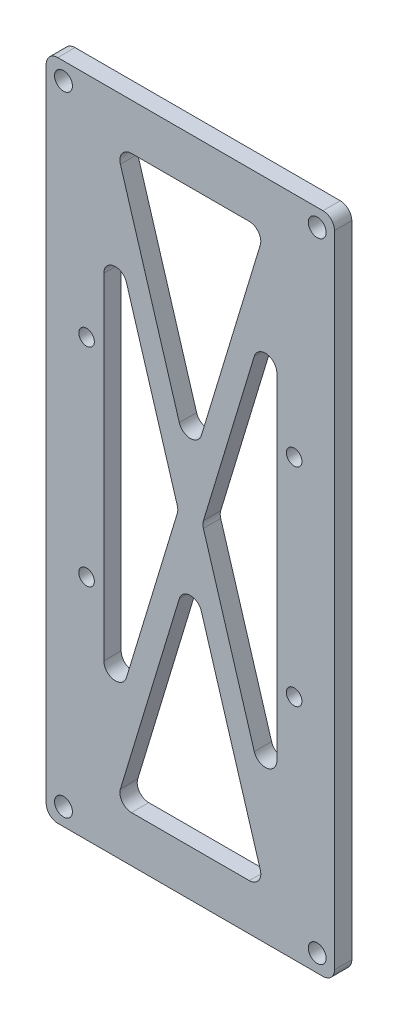
from build123d import *

# Parameters (mm, degrees)
SKETCH_1_W          = 50
SKETCH_1_H          = 50
SKETCH_1_R          = 1.35
EXTRUDE_1_DEPTH     = 3
EXTRUDE_START       = -3
SKETCH_2_W          = 50
SKETCH_2_H          = 115
SKETCH_2_R          = 1.35
SKETCH_2_R_2        = 1.55
EXTRUDE_2_DEPTH     = 3
CUT_EXTRUDE_1_DEPTH = 63.77141069
FILLET_2_R          = 2


with BuildPart() as part:
    # 草图1 → 凸台-拉伸1 (new body)
    with BuildSketch(Plane.XY):
        Rectangle(SKETCH_1_W, SKETCH_1_H)
        with Locations((18, 18)):
            Circle(SKETCH_1_R, mode=Mode.SUBTRACT)
        with Locations((-18, 18)):
            Circle(SKETCH_1_R, mode=Mode.SUBTRACT)
        with Locations((-18, -18)):
            Circle(SKETCH_1_R, mode=Mode.SUBTRACT)
        with Locations((18, -18)):
            Circle(SKETCH_1_R, mode=Mode.SUBTRACT)
    extrude(amount=EXTRUDE_1_DEPTH)

    # 草图2 → 凸台-拉伸2 (add)
    with BuildSketch(Plane.XY.offset(3).offset(EXTRUDE_START)):
        Rectangle(SKETCH_2_W, SKETCH_2_H)
        with Locations((18, 18)):
            Circle(SKETCH_2_R, mode=Mode.SUBTRACT)
        with Locations((18, -18)):
            Circle(SKETCH_2_R, mode=Mode.SUBTRACT)
        with Locations((-18, -18)):
            Circle(SKETCH_2_R, mode=Mode.SUBTRACT)
        with Locations((-18, 18)):
            Circle(SKETCH_2_R, mode=Mode.SUBTRACT)
        with Locations((-22, 54.5)):
            Circle(SKETCH_2_R_2, mode=Mode.SUBTRACT)
        with Locations((22, 54.5)):
            Circle(SKETCH_2_R_2, mode=Mode.SUBTRACT)
        with Locations((-22, -54.5)):
            Circle(SKETCH_2_R_2, mode=Mode.SUBTRACT)
        with Locations((22, -54.5)):
            Circle(SKETCH_2_R_2, mode=Mode.SUBTRACT)
    extrude(amount=EXTRUDE_2_DEPTH)

    # 草图8 → 切除-拉伸1 (cut, through all)
    with BuildSketch(Plane.XY.offset(3)):
        Polygon((12.910189133, -49.5), (0, -6.89637586), (-12.910189133, -49.5), align=None)
        Polygon((15, 42.60362414), (2.089810867, 0), (15, -42.60362414), align=None)
        Polygon((12.910189133, 49.5), (-12.910189133, 49.5), (0, 6.89637586), align=None)
        Polygon((-2.089810867, 0), (-15, 42.60362414), (-15, -42.60362414), align=None)
    extrude(amount=-CUT_EXTRUDE_1_DEPTH, mode=Mode.SUBTRACT)

    # 圆角2
    fillet_2_edges = [part.edges().sort_by_distance(p)[0] for p in [
        (25, 57.5, 1.5),
        (-25, -57.5, 1.5),
        (25, -57.5, 1.5),
        (-25, 57.5, 1.5),
        (0, 6.89637586, 1.5),
        (-12.910189133, 49.5, 1.5),
        (12.910189133, 49.5, 1.5),
        (2.089810867, 0, 1.5),
        (15, 42.60362414, 1.5),
        (15, -42.60362414, 1.5),
        (-15, -42.60362414, 1.5),
        (-15, 42.60362414, 1.5),
        (-2.089810867, 0, 1.5),
        (-12.910189133, -49.5, 1.5),
        (0, -6.89637586, 1.5),
        (12.910189133, -49.5, 1.5),
    ]]
    fillet(fillet_2_edges, radius=FILLET_2_R)


solid = part.part
